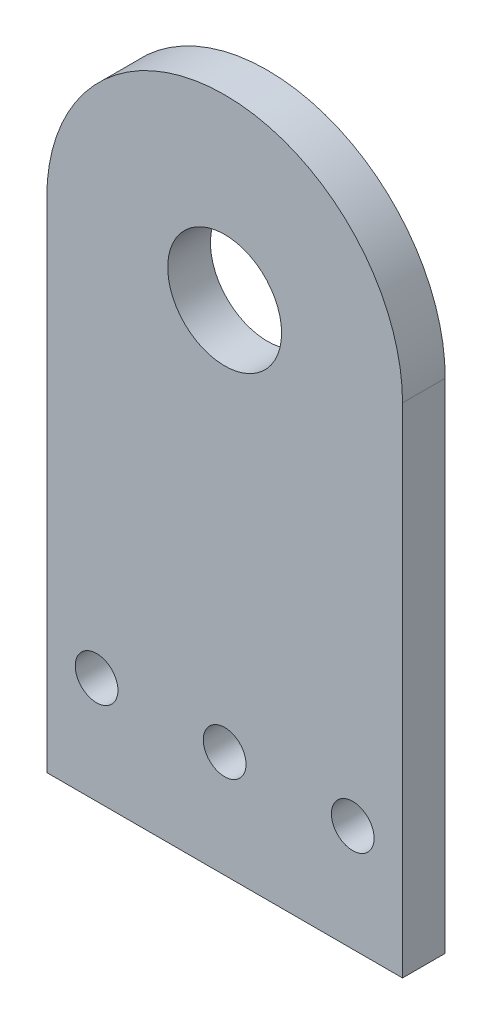
from build123d import *

# Parameters (mm, degrees)
EXTRUDE_1_DEPTH     = 3
SKETCH_3_R          = 4
CUT_EXTRUDE_1_DEPTH = 33.638167841
SKETCH_4_R          = 1.5
CUT_EXTRUDE_2_DEPTH = 33.638167841


with BuildPart() as part:
    # 草图2 → 凸台-拉伸1 (new body)
    with BuildSketch(Plane.XY):
        with BuildLine():
            Line((-12.5, 17.5), (-12.5, -17.5))
            Line((-12.5, -17.5), (12.5, -17.5))
            Line((12.5, -17.5), (12.5, 17.5))
            ThreePointArc((12.5, 17.5), (0, 30), (-12.5, 17.5))
        make_face()
    extrude(amount=EXTRUDE_1_DEPTH)

    # 草图3 → 切除-拉伸1 (cut, through all)
    with BuildSketch(Plane.XY.offset(3)):
        with Locations((0, 17.5)):
            Circle(SKETCH_3_R)
    extrude(amount=-CUT_EXTRUDE_1_DEPTH, mode=Mode.SUBTRACT)

    # 草图4 → 切除-拉伸2 (cut, through all)
    with BuildSketch(Plane.XY.offset(3)):
        with Locations((-9, -10)):
            Circle(SKETCH_4_R)
        with Locations((0, -10)):
            Circle(SKETCH_4_R)
        with Locations(Location((9, -10, 0), (0, 0, 180))):
            Circle(SKETCH_4_R)
    extrude(amount=-CUT_EXTRUDE_2_DEPTH, mode=Mode.SUBTRACT)


solid = part.part
